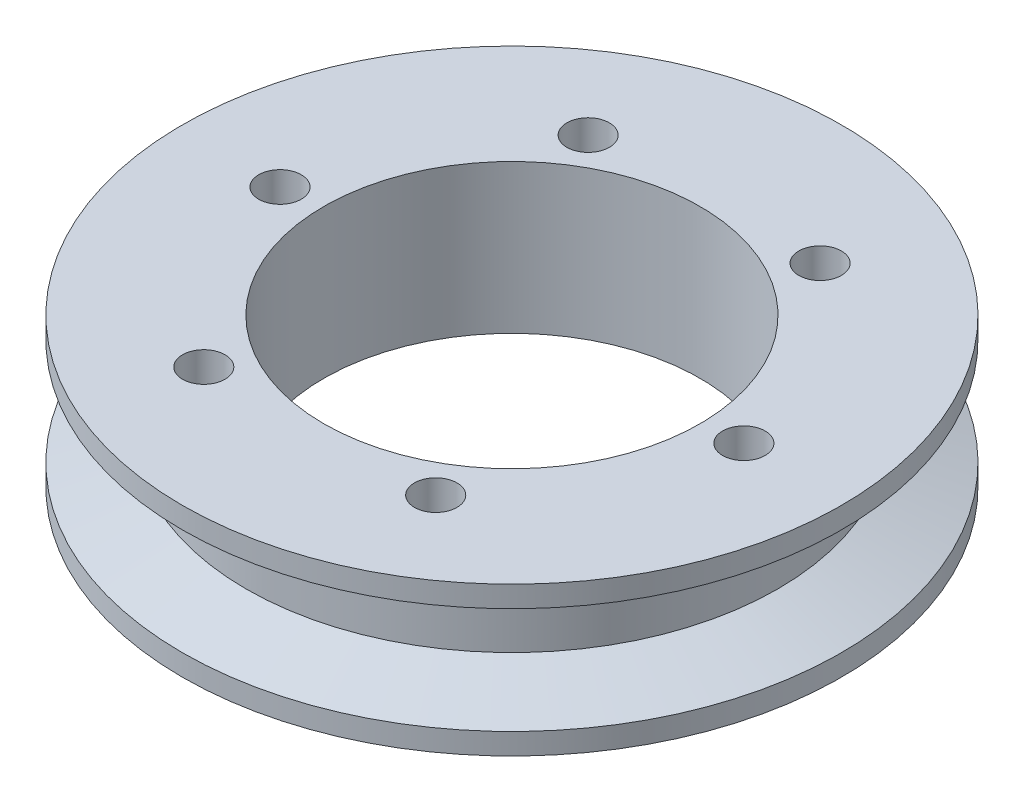
from build123d import *

# Parameters (mm, degrees)
SKETCH2_R          = 2
CUT_EXTRUDE1_DEPTH = 14


with BuildPart() as part:
    # Sketch1 → Revolve1 (revolve)
    with BuildSketch(Plane.XY, mode=Mode.PRIVATE) as revolve1_sk:
        Polygon((-17.7, 8.175689529), (-17.7, -5.824310471), (-31, -5.824310471), (-31, -3.824310471), (-25, -1.639310471), (-25, 3.990689529), (-31, 6.175689529), (-31, 8.175689529), align=None)
    revolve(revolve1_sk.sketch.rotate(Axis((0, 20.732962991, 0), (0, -1, 0)), 270), axis=Axis((0, 20.732962991, 0), (0, -1, 0)))

    # Sketch2 → Cut-Extrude1 (cut)
    with BuildSketch(Plane(origin=(0, 8.175689529, 0), x_dir=(1, 0, 0), z_dir=(0, 1, 0))):
        with Locations(Location((11.081162791, -18.249118642, 0), (0, 0, 270))):
            Circle(SKETCH2_R)
        with Locations(Location((-10.263618945, -18.721127801, 0), (0, 0, 270))):
            Circle(SKETCH2_R)
        with Locations(Location((-21.344781736, -0.472009159, 0), (0, 0, 270))):
            Circle(SKETCH2_R)
        with Locations(Location((-11.081162791, 18.249118642, 0), (0, 0, 270))):
            Circle(SKETCH2_R)
        with Locations(Location((10.263618945, 18.721127801, 0), (0, 0, 270))):
            Circle(SKETCH2_R)
        with Locations(Location((21.344781736, 0.472009159, 0), (0, 0, 270))):
            Circle(SKETCH2_R)
    extrude(amount=-CUT_EXTRUDE1_DEPTH, mode=Mode.SUBTRACT)


solid = part.part
